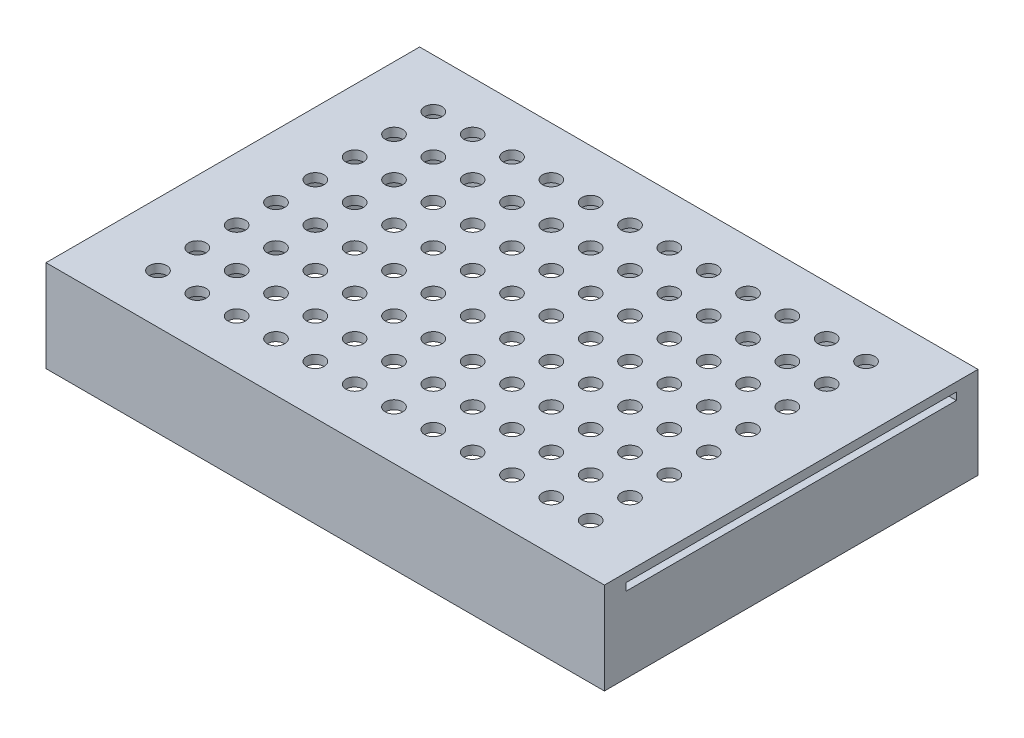
from build123d import *

# Parameters (mm, degrees)
ESQUISSE1_W               = 127.76
ESQUISSE1_H               = 85.48
BASE_STOCK_DEPTH          = 21
ESQUISSE2_W               = 111.96
ESQUISSE2_H               = 75.68
ENL_V_MAT_EXTRU_2_DEPTH   = 19
ESQUISSE3_R               = 2
VIAL_HOLES_DEPTH          = 80.676608864
CONG_1_R                  = 5
ESQUISSE5_R               = 1.55
MAGNET_HOLES_DEPTH        = 3
MAGNET_HOLES_CHAMFER_SIZE = 0.2
ESQUISSE6_R               = 0.75
MAGNET_HOLES_AIR_DEPTH    = 2
ESQUISSE7_W               = 75.6
ESQUISSE7_H               = 1.7
ENL_V_MAT_EXTRU_3_DEPTH   = 137.346342819


with BuildPart() as part:
    # Esquisse1 → Base Stock (new body)
    with BuildSketch(Plane(origin=(0, 0, 0), x_dir=(1, 0, 0), z_dir=(0, 1, 0))):
        Rectangle(ESQUISSE1_W, ESQUISSE1_H)
    extrude(amount=BASE_STOCK_DEPTH)

    # Esquisse2 → Enlèv. mat.-Extru.2 (cut)
    with BuildSketch(Plane.XZ):
        Rectangle(ESQUISSE2_W, ESQUISSE2_H)
    extrude(amount=-ENL_V_MAT_EXTRU_2_DEPTH, mode=Mode.SUBTRACT)

    # Esquisse3 → Vial Holes (cut, through all)
    with BuildSketch(Plane(origin=(0, 21, 0), x_dir=(1, 0, 0), z_dir=(0, 1, 0))):
        with Locations(Location((-49.5, 31.5, 0), (0, 0, 270))):
            Circle(ESQUISSE3_R)
        with Locations(Location((-40.5, 31.5, 0), (0, 0, 270))):
            Circle(ESQUISSE3_R)
        with Locations(Location((-31.5, 31.5, 0), (0, 0, 270))):
            Circle(ESQUISSE3_R)
        with Locations(Location((-22.5, 31.5, 0), (0, 0, 270))):
            Circle(ESQUISSE3_R)
        with Locations(Location((-13.5, 31.5, 0), (0, 0, 270))):
            Circle(ESQUISSE3_R)
        with Locations(Location((-4.5, 31.5, 0), (0, 0, 270))):
            Circle(ESQUISSE3_R)
        with Locations(Location((4.5, 31.5, 0), (0, 0, 270))):
            Circle(ESQUISSE3_R)
        with Locations(Location((13.5, 31.5, 0), (0, 0, 270))):
            Circle(ESQUISSE3_R)
        with Locations(Location((22.5, 31.5, 0), (0, 0, 270))):
            Circle(ESQUISSE3_R)
        with Locations(Location((31.5, 31.5, 0), (0, 0, 270))):
            Circle(ESQUISSE3_R)
        with Locations(Location((40.5, 31.5, 0), (0, 0, 270))):
            Circle(ESQUISSE3_R)
        with Locations(Location((49.5, 31.5, 0), (0, 0, 270))):
            Circle(ESQUISSE3_R)
        with Locations(Location((-40.5, 22.5, 0), (0, 0, 270))):
            Circle(ESQUISSE3_R)
        with Locations(Location((-31.5, 22.5, 0), (0, 0, 270))):
            Circle(ESQUISSE3_R)
        with Locations(Location((-22.5, 22.5, 0), (0, 0, 270))):
            Circle(ESQUISSE3_R)
        with Locations(Location((-13.5, 22.5, 0), (0, 0, 270))):
            Circle(ESQUISSE3_R)
        with Locations(Location((-4.5, 22.5, 0), (0, 0, 270))):
            Circle(ESQUISSE3_R)
        with Locations(Location((4.5, 22.5, 0), (0, 0, 270))):
            Circle(ESQUISSE3_R)
        with Locations(Location((13.5, 22.5, 0), (0, 0, 270))):
            Circle(ESQUISSE3_R)
        with Locations(Location((22.5, 22.5, 0), (0, 0, 270))):
            Circle(ESQUISSE3_R)
        with Locations(Location((31.5, 22.5, 0), (0, 0, 270))):
            Circle(ESQUISSE3_R)
        with Locations(Location((40.5, 22.5, 0), (0, 0, 270))):
            Circle(ESQUISSE3_R)
        with Locations(Location((49.5, 22.5, 0), (0, 0, 270))):
            Circle(ESQUISSE3_R)
        with Locations(Location((-40.5, 13.5, 0), (0, 0, 270))):
            Circle(ESQUISSE3_R)
        with Locations(Location((-31.5, 13.5, 0), (0, 0, 270))):
            Circle(ESQUISSE3_R)
        with Locations(Location((-22.5, 13.5, 0), (0, 0, 270))):
            Circle(ESQUISSE3_R)
        with Locations(Location((-13.5, 13.5, 0), (0, 0, 270))):
            Circle(ESQUISSE3_R)
        with Locations(Location((-4.5, 13.5, 0), (0, 0, 270))):
            Circle(ESQUISSE3_R)
        with Locations(Location((4.5, 13.5, 0), (0, 0, 270))):
            Circle(ESQUISSE3_R)
        with Locations(Location((13.5, 13.5, 0), (0, 0, 270))):
            Circle(ESQUISSE3_R)
        with Locations(Location((22.5, 13.5, 0), (0, 0, 270))):
            Circle(ESQUISSE3_R)
        with Locations(Location((31.5, 13.5, 0), (0, 0, 270))):
            Circle(ESQUISSE3_R)
        with Locations(Location((40.5, 13.5, 0), (0, 0, 270))):
            Circle(ESQUISSE3_R)
        with Locations(Location((49.5, 13.5, 0), (0, 0, 270))):
            Circle(ESQUISSE3_R)
        with Locations(Location((-40.5, 4.5, 0), (0, 0, 270))):
            Circle(ESQUISSE3_R)
        with Locations(Location((-31.5, 4.5, 0), (0, 0, 270))):
            Circle(ESQUISSE3_R)
        with Locations(Location((-22.5, 4.5, 0), (0, 0, 270))):
            Circle(ESQUISSE3_R)
        with Locations(Location((-13.5, 4.5, 0), (0, 0, 270))):
            Circle(ESQUISSE3_R)
        with Locations(Location((-4.5, 4.5, 0), (0, 0, 270))):
            Circle(ESQUISSE3_R)
        with Locations(Location((4.5, 4.5, 0), (0, 0, 270))):
            Circle(ESQUISSE3_R)
        with Locations(Location((13.5, 4.5, 0), (0, 0, 270))):
            Circle(ESQUISSE3_R)
        with Locations(Location((22.5, 4.5, 0), (0, 0, 270))):
            Circle(ESQUISSE3_R)
        with Locations(Location((31.5, 4.5, 0), (0, 0, 270))):
            Circle(ESQUISSE3_R)
        with Locations(Location((40.5, 4.5, 0), (0, 0, 270))):
            Circle(ESQUISSE3_R)
        with Locations(Location((49.5, 4.5, 0), (0, 0, 270))):
            Circle(ESQUISSE3_R)
        with Locations(Location((-40.5, -4.5, 0), (0, 0, 270))):
            Circle(ESQUISSE3_R)
        with Locations(Location((-31.5, -4.5, 0), (0, 0, 270))):
            Circle(ESQUISSE3_R)
        with Locations(Location((-22.5, -4.5, 0), (0, 0, 270))):
            Circle(ESQUISSE3_R)
        with Locations(Location((-13.5, -4.5, 0), (0, 0, 270))):
            Circle(ESQUISSE3_R)
        with Locations(Location((-4.5, -4.5, 0), (0, 0, 270))):
            Circle(ESQUISSE3_R)
        with Locations(Location((4.5, -4.5, 0), (0, 0, 270))):
            Circle(ESQUISSE3_R)
        with Locations(Location((13.5, -4.5, 0), (0, 0, 270))):
            Circle(ESQUISSE3_R)
        with Locations(Location((22.5, -4.5, 0), (0, 0, 270))):
            Circle(ESQUISSE3_R)
        with Locations(Location((31.5, -4.5, 0), (0, 0, 270))):
            Circle(ESQUISSE3_R)
        with Locations(Location((40.5, -4.5, 0), (0, 0, 270))):
            Circle(ESQUISSE3_R)
        with Locations(Location((49.5, -4.5, 0), (0, 0, 270))):
            Circle(ESQUISSE3_R)
        with Locations(Location((-40.5, -13.5, 0), (0, 0, 270))):
            Circle(ESQUISSE3_R)
        with Locations(Location((-31.5, -13.5, 0), (0, 0, 270))):
            Circle(ESQUISSE3_R)
        with Locations(Location((-22.5, -13.5, 0), (0, 0, 270))):
            Circle(ESQUISSE3_R)
        with Locations(Location((-13.5, -13.5, 0), (0, 0, 270))):
            Circle(ESQUISSE3_R)
        with Locations(Location((-4.5, -13.5, 0), (0, 0, 270))):
            Circle(ESQUISSE3_R)
        with Locations(Location((4.5, -13.5, 0), (0, 0, 270))):
            Circle(ESQUISSE3_R)
        with Locations(Location((13.5, -13.5, 0), (0, 0, 270))):
            Circle(ESQUISSE3_R)
        with Locations(Location((22.5, -13.5, 0), (0, 0, 270))):
            Circle(ESQUISSE3_R)
        with Locations(Location((31.5, -13.5, 0), (0, 0, 270))):
            Circle(ESQUISSE3_R)
        with Locations(Location((40.5, -13.5, 0), (0, 0, 270))):
            Circle(ESQUISSE3_R)
        with Locations(Location((49.5, -13.5, 0), (0, 0, 270))):
            Circle(ESQUISSE3_R)
        with Locations(Location((-40.5, -22.5, 0), (0, 0, 270))):
            Circle(ESQUISSE3_R)
        with Locations(Location((-31.5, -22.5, 0), (0, 0, 270))):
            Circle(ESQUISSE3_R)
        with Locations(Location((-22.5, -22.5, 0), (0, 0, 270))):
            Circle(ESQUISSE3_R)
        with Locations(Location((-13.5, -22.5, 0), (0, 0, 270))):
            Circle(ESQUISSE3_R)
        with Locations(Location((-4.5, -22.5, 0), (0, 0, 270))):
            Circle(ESQUISSE3_R)
        with Locations(Location((4.5, -22.5, 0), (0, 0, 270))):
            Circle(ESQUISSE3_R)
        with Locations(Location((13.5, -22.5, 0), (0, 0, 270))):
            Circle(ESQUISSE3_R)
        with Locations(Location((22.5, -22.5, 0), (0, 0, 270))):
            Circle(ESQUISSE3_R)
        with Locations(Location((31.5, -22.5, 0), (0, 0, 270))):
            Circle(ESQUISSE3_R)
        with Locations(Location((40.5, -22.5, 0), (0, 0, 270))):
            Circle(ESQUISSE3_R)
        with Locations(Location((49.5, -22.5, 0), (0, 0, 270))):
            Circle(ESQUISSE3_R)
        with Locations(Location((-40.5, -31.5, 0), (0, 0, 270))):
            Circle(ESQUISSE3_R)
        with Locations(Location((-31.5, -31.5, 0), (0, 0, 270))):
            Circle(ESQUISSE3_R)
        with Locations(Location((-22.5, -31.5, 0), (0, 0, 270))):
            Circle(ESQUISSE3_R)
        with Locations(Location((-13.5, -31.5, 0), (0, 0, 270))):
            Circle(ESQUISSE3_R)
        with Locations(Location((-4.5, -31.5, 0), (0, 0, 270))):
            Circle(ESQUISSE3_R)
        with Locations(Location((4.5, -31.5, 0), (0, 0, 270))):
            Circle(ESQUISSE3_R)
        with Locations(Location((13.5, -31.5, 0), (0, 0, 270))):
            Circle(ESQUISSE3_R)
        with Locations(Location((22.5, -31.5, 0), (0, 0, 270))):
            Circle(ESQUISSE3_R)
        with Locations(Location((31.5, -31.5, 0), (0, 0, 270))):
            Circle(ESQUISSE3_R)
        with Locations(Location((40.5, -31.5, 0), (0, 0, 270))):
            Circle(ESQUISSE3_R)
        with Locations(Location((49.5, -31.5, 0), (0, 0, 270))):
            Circle(ESQUISSE3_R)
        with Locations(Location((-49.5, 22.5, 0), (0, 0, 270))):
            Circle(ESQUISSE3_R)
        with Locations(Location((-49.5, 13.5, 0), (0, 0, 270))):
            Circle(ESQUISSE3_R)
        with Locations(Location((-49.5, 4.5, 0), (0, 0, 270))):
            Circle(ESQUISSE3_R)
        with Locations(Location((-49.5, -4.5, 0), (0, 0, 270))):
            Circle(ESQUISSE3_R)
        with Locations(Location((-49.5, -13.5, 0), (0, 0, 270))):
            Circle(ESQUISSE3_R)
        with Locations(Location((-49.5, -22.5, 0), (0, 0, 270))):
            Circle(ESQUISSE3_R)
        with Locations(Location((-49.5, -31.5, 0), (0, 0, 270))):
            Circle(ESQUISSE3_R)
    extrude(amount=-VIAL_HOLES_DEPTH, mode=Mode.SUBTRACT)

    # Congé1
    cong_1_edges = [part.edges().sort_by_distance(p)[0] for p in [
        (-55.98, 9.5, -37.84),
        (-55.98, 9.5, 37.84),
        (55.98, 9.5, 37.84),
        (55.98, 9.5, -37.84),
    ]]
    fillet(cong_1_edges, radius=CONG_1_R)

    # Esquisse5 → Magnet Holes (cut)
    with BuildSketch(Plane.XZ):
        with Locations(Location((-59.93, 40.29, 0), (0, 0, 270))):
            Circle(ESQUISSE5_R)
        with Locations(Location((0, 40.29, 0), (0, 0, 270))):
            Circle(ESQUISSE5_R)
        with Locations(Location((-59.93, 0, 0), (0, 0, 270))):
            Circle(ESQUISSE5_R)
        with Locations(Location((59.93, 0, 0), (0, 0, 90))):
            Circle(ESQUISSE5_R)
        with Locations(Location((59.93, 40.29, 0), (0, 0, 90))):
            Circle(ESQUISSE5_R)
        with Locations(Location((59.93, -40.29, 0), (0, 0, 270))):
            Circle(ESQUISSE5_R)
        with Locations(Location((0, -40.29, 0), (0, 0, 90))):
            Circle(ESQUISSE5_R)
        with Locations(Location((-59.93, -40.29, 0), (0, 0, 90))):
            Circle(ESQUISSE5_R)
    extrude(amount=-MAGNET_HOLES_DEPTH, mode=Mode.SUBTRACT)

    # Magnet Holes Chamfer
    magnet_holes_chamfer_edges = [part.edges().sort_by_distance(p)[0] for p in [
        (-59.93, 0, -41.84),
        (0, 0, -41.84),
        (59.93, 0, -38.74),
        (59.93, 0, 38.74),
        (59.93, 0, -1.55),
        (-59.93, 0, 1.55),
        (0, 0, 41.84),
        (-59.93, 0, 41.84),
    ]]
    chamfer(magnet_holes_chamfer_edges, length=MAGNET_HOLES_CHAMFER_SIZE)

    # Esquisse6 → Magnet Holes Air (cut)
    with BuildSketch(Plane.XZ.offset(-3)):
        with Locations(Location((-59.93, 0, 0), (0, 0, 270))):
            Circle(ESQUISSE6_R)
        with Locations(Location((-59.93, 40.29, 0), (0, 0, 270))):
            Circle(ESQUISSE6_R)
        with Locations(Location((0, 40.29, 0), (0, 0, 270))):
            Circle(ESQUISSE6_R)
        with Locations(Location((59.93, 40.29, 0), (0, 0, 270))):
            Circle(ESQUISSE6_R)
        with Locations(Location((59.93, 0, 0), (0, 0, 270))):
            Circle(ESQUISSE6_R)
        with Locations(Location((59.93, -40.29, 0), (0, 0, 270))):
            Circle(ESQUISSE6_R)
        with Locations(Location((0, -40.29, 0), (0, 0, 270))):
            Circle(ESQUISSE6_R)
        with Locations(Location((-59.93, -40.29, 0), (0, 0, 270))):
            Circle(ESQUISSE6_R)
    extrude(amount=-MAGNET_HOLES_AIR_DEPTH, mode=Mode.SUBTRACT)

    # Esquisse7 → Enlèv. mat.-Extru.3 (cut, through all)
    with BuildSketch(Plane(origin=(-63.88, 0, 0), x_dir=(0, 0, -1), z_dir=(1, 0, 0))):
        with Locations((0, 18.15)):
            Rectangle(ESQUISSE7_W, ESQUISSE7_H)
    extrude(amount=ENL_V_MAT_EXTRU_3_DEPTH, mode=Mode.SUBTRACT)


solid = part.part
